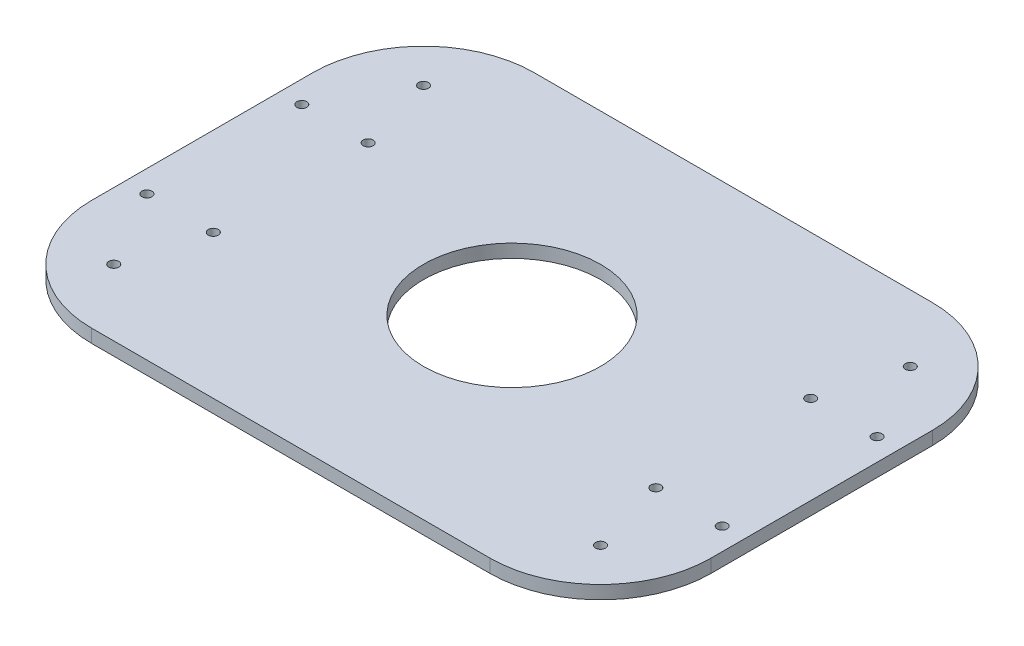
from build123d import *

# Parameters (mm, degrees)
SKETCH_6_W          = 440
SKETCH_6_H          = 200
SKETCH_6_R          = 40
EXTRUDE_2_DEPTH     = 6
SKETCH_7_R          = 2.25
CUT_EXTRUDE_1_DEPTH = 10


with BuildPart() as part:
    # 草图6 → 凸台-拉伸2 (new body)
    with BuildSketch(Plane(origin=(0, 0, 0), x_dir=(1, 0, 0), z_dir=(0, 1, 0))):
        Rectangle(SKETCH_6_W, SKETCH_6_H)
        with Locations(Location((0, 0, 0), (0, 0, 270))):
            Circle(SKETCH_6_R, mode=Mode.SUBTRACT)
    extrude(amount=EXTRUDE_2_DEPTH)

    # 草图7 → 切除-拉伸1 (cut)
    with BuildSketch(Plane(origin=(0, 6, 0), x_dir=(1, 0, 0), z_dir=(0, 1, 0))):
        with BuildLine():
            Line((-140, -50), (-140, 50))
            ThreePointArc((-140, 50), (-125.355339059, 85.355339059), (-90, 100))
            Line((-90, 100), (-220, 100))
            Line((-220, 100), (-220, -100))
            Line((-220, -100), (-90, -100))
            ThreePointArc((-90, -100), (-125.355339059, -85.355339059), (-140, -50))
        make_face()
        with BuildLine():
            Line((220, 100), (90, 100))
            ThreePointArc((90, 100), (125.355339059, 85.355339059), (140, 50))
            Line((140, 50), (140, -50))
            ThreePointArc((140, -50), (125.355339059, -85.355339059), (90, -100))
            Line((90, -100), (220, -100))
            Line((220, -100), (220, 100))
        make_face()
        with Locations(Location((-130, 35, 0), (0, 0, 270))):
            Circle(SKETCH_7_R)
        with Locations(Location((-100, 35, 0), (0, 0, 270))):
            Circle(SKETCH_7_R)
        with Locations(Location((-110, 70, 0), (0, 0, 270))):
            Circle(SKETCH_7_R)
        with Locations(Location((110, 70, 0), (0, 0, 270))):
            Circle(SKETCH_7_R)
        with Locations(Location((100, 35, 0), (0, 0, 270))):
            Circle(SKETCH_7_R)
        with Locations(Location((130, 35, 0), (0, 0, 270))):
            Circle(SKETCH_7_R)
        with Locations(Location((130, -35, 0), (0, 0, 270))):
            Circle(SKETCH_7_R)
        with Locations(Location((100, -35, 0), (0, 0, 270))):
            Circle(SKETCH_7_R)
        with Locations(Location((110, -70, 0), (0, 0, 270))):
            Circle(SKETCH_7_R)
        with Locations(Location((-110, -70, 0), (0, 0, 270))):
            Circle(SKETCH_7_R)
        with Locations(Location((-100, -35, 0), (0, 0, 270))):
            Circle(SKETCH_7_R)
        with Locations(Location((-130, -35, 0), (0, 0, 270))):
            Circle(SKETCH_7_R)
    extrude(amount=-CUT_EXTRUDE_1_DEPTH, mode=Mode.SUBTRACT)


solid = part.part
